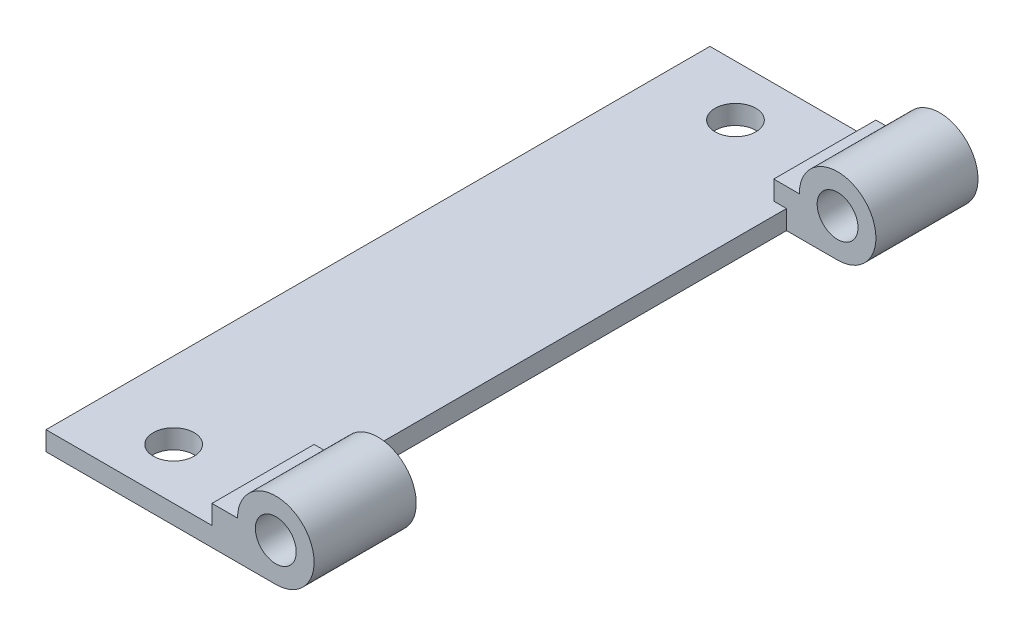
from build123d import *

# Parameters (mm, degrees)
EXTRUDE_START             = -26
SKETCH_1_W                = 14
SKETCH_1_H                = 1.5
EXTRUDE_241_DEPTH         = 52
SKETCH_2_W                = 5
SKETCH_2_H                = 3
EXTRUDE_321_DEPTH         = 8
SKETCH_3_R                = 3
EXTRUDE_392_DEPTH         = 8
EXTRUDE_START_2           = 18
SKETCH_4_W                = 5
SKETCH_4_H                = 3
EXTRUDE_4_DEPTH           = 8
SKETCH_5_R                = 3
EXTRUDE_5_DEPTH           = 8
D3P2_START                = -28
SKETCH_6_R                = 1.6
D3P2_DEPTH                = 56
CUT_EXTRUDE_M3_DEPTH      = 100
CUT_EXTRUDE_M3_DEPTH_BACK = 100
SKETCH_7_R                = 1.6
CUT_EXTRUDE_3_DEPTH       = 100
CUT_EXTRUDE_3_DEPTH_BACK  = 100
SKETCH_8_R                = 1.6


with BuildPart() as part:
    # 草图1 → Extrude 241 (new body)
    with BuildSketch(Plane.XY.offset(EXTRUDE_START)):
        with Locations((-11, -2.25)):
            Rectangle(SKETCH_1_W, SKETCH_1_H)
    extrude(amount=EXTRUDE_241_DEPTH)

    # 草图2 → Extrude 321 (add)
    with BuildSketch(Plane.XY.offset(EXTRUDE_START)):
        with Locations((-2.5, -1.5)):
            Rectangle(SKETCH_2_W, SKETCH_2_H)
    extrude(amount=EXTRUDE_321_DEPTH)

    # 草图3 → Extrude 392 (add)
    with BuildSketch(Plane.XY.offset(EXTRUDE_START)):
        Circle(SKETCH_3_R)
    extrude(amount=EXTRUDE_392_DEPTH)

    # 草图4 → 凸台-拉伸4 (add)
    with BuildSketch(Plane.XY.offset(EXTRUDE_START_2)):
        with Locations((-2.5, -1.5)):
            Rectangle(SKETCH_4_W, SKETCH_4_H)
    extrude(amount=EXTRUDE_4_DEPTH)

    # 草图5 → 凸台-拉伸5 (add)
    with BuildSketch(Plane.XY.offset(EXTRUDE_START_2)):
        Circle(SKETCH_5_R)
    extrude(amount=EXTRUDE_5_DEPTH)

    # 草图6 → D3p2转轴通孔 (cut)
    with BuildSketch(Plane.XY.offset(D3P2_START)):
        Circle(SKETCH_6_R)
    extrude(amount=D3P2_DEPTH, mode=Mode.SUBTRACT)

    # 草图7 → 底板M3安装孔 (cut, two sides: drawn at the far end of the back side and taken through both)
    with BuildSketch(Plane(origin=(0, 0, 0), x_dir=(1, 0, 0), z_dir=(0, 1, 0)).offset(-CUT_EXTRUDE_M3_DEPTH_BACK)):
        with Locations(Location((-12, 22, 0), (0, 0, 270))):
            Circle(SKETCH_7_R)
    extrude(amount=CUT_EXTRUDE_M3_DEPTH + CUT_EXTRUDE_M3_DEPTH_BACK, mode=Mode.SUBTRACT)

    # 草图8 → 切除-拉伸3 (cut, two sides: drawn at the far end of the back side and taken through both)
    with BuildSketch(Plane(origin=(0, 0, 0), x_dir=(1, 0, 0), z_dir=(0, 1, 0)).offset(-CUT_EXTRUDE_3_DEPTH_BACK)):
        with Locations(Location((-12, -22, 0), (0, 0, 270))):
            Circle(SKETCH_8_R)
    extrude(amount=CUT_EXTRUDE_3_DEPTH + CUT_EXTRUDE_3_DEPTH_BACK, mode=Mode.SUBTRACT)


solid = part.part
